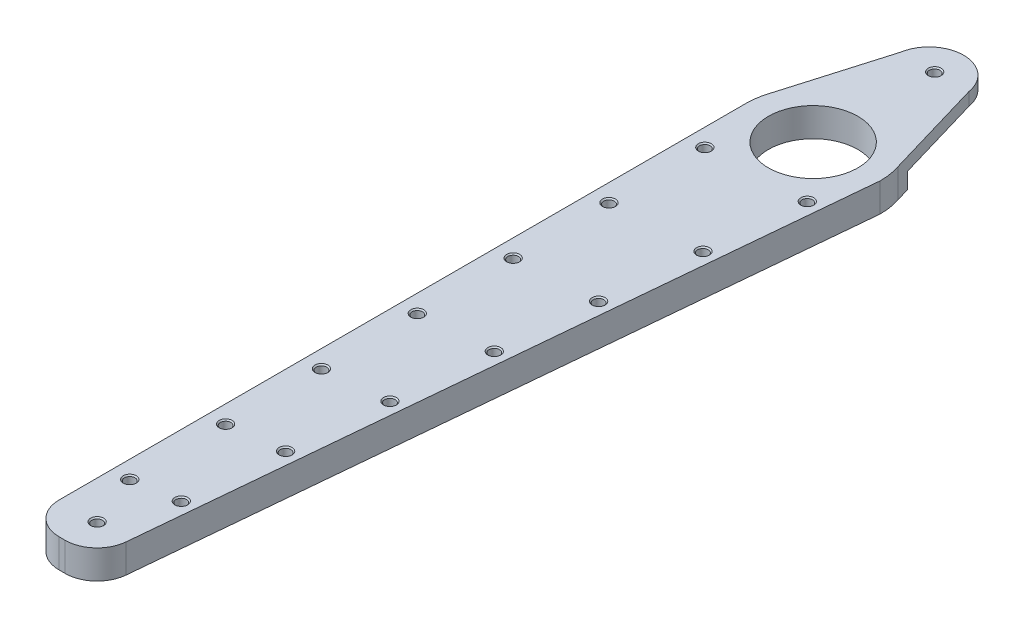
from build123d import *
from build123d.topology import SkipClean

# Parameters (mm, degrees)
EXTRUDE_1_DEPTH               = 15
CUT_EXTRUDE_1_DEPTH           = 4
SKETCH_3_R                    = 14
CUT_EXTRUDE_2_DEPTH           = 227.475164201
EXTRUDE_4_DEPTH               = 15
SKETCH_11_W                   = 17
SKETCH_11_H                   = 10
SKETCH_14_W                   = 6
SKETCH_14_H                   = 10
CUT_REVOLVE_4_ANGLE           = 60
CUT_REVOLVE_4_OTHER_WAY_ANGLE = 90
SKETCH_16_W                   = 9.609453317
SKETCH_16_H                   = 10
CUT_EXTRUDE_4_DEPTH           = 5
SKETCH_17_W                   = 9.609453317
SKETCH_17_H                   = 10
CUT_EXTRUDE_5_DEPTH           = 5
CUT_EXTRUDE_6_DEPTH           = 7.5
EXTRUDE_START                 = 1.5
EXTRUDE_6_DEPTH               = 1.5
SKETCH_21_R                   = 5
SKETCH_21_R_2                 = 14
EXTRUDE_7_DEPTH               = 1.5
HOLE_WIZARD_M4_1_D            = 3.3
HOLE_WIZARD_M4_1_DEPTH        = 9
HOLE_WIZARD_M4_1_CSINK_D      = 4.05
HOLE_WIZARD_M4_1_CSINK_ANGLE  = 90


with BuildPart() as part:
    # 草图1 → 凸台-拉伸1 (new body)
    with BuildSketch(Plane(origin=(0, 0, 0), x_dir=(1, 0, 0), z_dir=(0, 1, 0))):
        with BuildLine():
            Line((-21, 0), (-21, -215))
            ThreePointArc((-21, -215), (-18.071067812, -222.071067812), (-11, -225))
            Line((-11, -225), (-9.110127779, -225))
            ThreePointArc((-9.110127779, -225), (-2.375625019, -222.392325249), (0.846599179, -215.929294516))
            Line((0.846599179, -215.929294516), (21, 0))
            ThreePointArc((21, 0), (0, 21), (-21, 0))
        make_face()
    extrude(amount=EXTRUDE_1_DEPTH)

    # 草图2 → 切除-拉伸1 (cut)
    with BuildSketch(Plane.XZ):
        with BuildLine():
            Line((-6.487547308, 24.545681698), (-15.16946684, 197.954199749))
            ThreePointArc((-15.16946684, 197.954199749), (-9.006726896, 204.766554422), (-2.194372223, 198.603814478))
            Line((-2.194372223, 198.603814478), (6.487547308, 25.195296427))
            ThreePointArc((6.487547308, 25.195296427), (0.324807364, 18.382941754), (-6.487547308, 24.545681698))
        make_face()
    extrude(amount=-CUT_EXTRUDE_1_DEPTH, mode=Mode.SUBTRACT)

    # 草图3 → 切除-拉伸2 (cut, through all)
    with BuildSketch(Plane(origin=(0, 0, 0), x_dir=(-1, 0, 0), z_dir=(0, -1, 0))):
        with Locations(Location((0, 0, 0), (0, 0, 90))):
            Circle(SKETCH_3_R)
    extrude(amount=-CUT_EXTRUDE_2_DEPTH, mode=Mode.SUBTRACT)

    # 草图7 → 凸台-拉伸4 (add)
    with BuildSketch(Plane(origin=(0, 0, 0), x_dir=(1, 0, 0), z_dir=(0, 1, 0))):
        with BuildLine():
            Line((-10.693069191, 38.039100971), (-19.9158097, 6.66036966))
            ThreePointArc((-19.9158097, 6.66036966), (0, 21), (19.9158097, 6.66036966))
            Line((19.9158097, 6.66036966), (10.693069191, 38.039100971))
            ThreePointArc((10.693069191, 38.039100971), (0, 47.113526612), (-10.693069191, 38.039100971))
        make_face()
    extrude(amount=EXTRUDE_4_DEPTH)

    # 草图11 → 切除-旋转3 (revolve, cut)
    with BuildSketch(Plane(origin=(0, 0, 0), x_dir=(0, 0, -1), z_dir=(1, 0, 0)), mode=Mode.PRIVATE) as cut_revolve_3_sk:
        with Locations((51.539100971, 7.5)):
            Rectangle(SKETCH_11_W, SKETCH_11_H)
    revolve(cut_revolve_3_sk.sketch.rotate(Axis((0, 15, -38.039100971), (0, -1, 0)), 180), axis=Axis((0, 15, -38.039100971), (0, -1, 0)), mode=Mode.SUBTRACT)

    # 草图14 → 切除-旋转4 (revolve, cut)
    with BuildSketch(Plane(origin=(0, 0, 0), x_dir=(0, 0, -1), z_dir=(1, 0, 0))):
        with Locations((19.26034239, 7.5)):
            Rectangle(SKETCH_14_W, SKETCH_14_H)
    revolve(axis=Axis((0, 15, 0), (0, -1, 0)), revolution_arc=CUT_REVOLVE_4_ANGLE, mode=Mode.SUBTRACT)

    # 草图14 → 切除-旋转4 other way (revolve, cut)
    with BuildSketch(Plane(origin=(0, 0, 0), x_dir=(0, 0, -1), z_dir=(1, 0, 0))):
        with Locations((19.26034239, 7.5)):
            Rectangle(SKETCH_14_W, SKETCH_14_H)
    revolve(axis=Axis((0, 15, 0), (0, 1, 0)), revolution_arc=CUT_REVOLVE_4_OTHER_WAY_ANGLE, mode=Mode.SUBTRACT)

    # 草图16 → 切除-拉伸4 (cut)
    with BuildSketch(Plane(origin=(20.13407913, 0, -5.917746812), x_dir=(-0.2819890835944097, 0, -0.9594176133121516), z_dir=(0.9594176133121516, 0, -0.2819890835944097))):
        with Locations((12.229144047, 7.5)):
            Rectangle(SKETCH_16_W, SKETCH_16_H)
    extrude(amount=-CUT_EXTRUDE_4_DEPTH, mode=Mode.SUBTRACT)

    # 草图17 → 切除-拉伸5 (cut)
    with BuildSketch(Plane(origin=(-20.13407913, 0, -5.917746812), x_dir=(-0.28198908359441, 0, 0.9594176133121515), z_dir=(-0.9594176133121515, 0, -0.28198908359441))):
        with Locations((-12.229144047, 7.5)):
            Rectangle(SKETCH_17_W, SKETCH_17_H)
    extrude(amount=-CUT_EXTRUDE_5_DEPTH, mode=Mode.SUBTRACT)

    # 草图20 → 切除-拉伸6 (cut)
    with BuildSketch(Plane.XZ):
        with BuildLine():
            Line((21, 0), (0.846599179, 215.929294516))
            ThreePointArc((0.846599179, 215.929294516), (-2.375625019, 222.392325249), (-9.110127779, 225))
            Line((-9.110127779, 225), (-11, 225))
            ThreePointArc((-11, 225), (-18.071067812, 222.071067812), (-21, 215))
            Line((-21, 215), (-21, 0))
            ThreePointArc((-21, 0), (-20.727180268, -3.374018102), (-19.9158097, -6.66036966))
            Line((-19.9158097, -6.66036966), (-10.693069191, -38.039100971))
            ThreePointArc((-10.693069191, -38.039100971), (0, -47.113526612), (10.693069191, -38.039100971))
            Line((10.693069191, -38.039100971), (19.9158097, -6.66036966))
            ThreePointArc((19.9158097, -6.66036966), (20.727180268, -3.374018102), (21, 0))
        make_face()
    extrude(amount=-CUT_EXTRUDE_6_DEPTH, mode=Mode.SUBTRACT)

    # 草图22 → 凸台-拉伸6 (add)
    with BuildSketch(Plane.XZ.offset(-12.5).offset(EXTRUDE_START)):
        with BuildLine():
            Line((-19.9158097, -6.66036966), (-10.693069191, -38.039100971))
            ThreePointArc((-10.693069191, -38.039100971), (0, -47.113526612), (10.693069191, -38.039100971))
            Line((10.693069191, -38.039100971), (18.700124508, -10.796521919))
            Line((18.700124508, -10.796521919), (14.081869584, -8.130171195))
            ThreePointArc((14.081869584, -8.130171195), (8.995321483, -13.545586959), (2.030780118, -16.133030303))
            ThreePointArc((2.030780118, -16.133030303), (0, -16.039100971), (-2.030780118, -16.133030303))
            ThreePointArc((-2.030780118, -16.133030303), (-12.194669218, -10.755871759), (-16.26034239, 0))
            Line((-16.26034239, 0), (-21, 0))
            ThreePointArc((-21, 0), (-20.727180268, -3.374018102), (-19.9158097, -6.66036966))
        make_face()
    extrude(amount=-EXTRUDE_6_DEPTH)

    # 草图21 → 凸台-拉伸7 (add)
    # profile 1 of 2: a face of its own
    with SkipClean():  # the faces are left unmerged after this step: merging them gives an invalid solid
        with BuildSketch(Plane.XZ.offset(-7.5).offset(EXTRUDE_START)):
            with Locations(Location((0, -38.039100971, 0), (0, 0, 270))):
                Circle(SKETCH_21_R)
        # profile 2 of 2: a face of its own
        with BuildSketch(Plane.XZ.offset(-7.5).offset(EXTRUDE_START)):
            with BuildLine():
                Line((-21, 0), (-16.26034239, 0))
                ThreePointArc((-16.26034239, 0), (-12.194669218, -10.755871759), (-2.030780118, -16.133030303))
                ThreePointArc((-2.030780118, -16.133030303), (0, -16.039100971), (2.030780118, -16.133030303))
                ThreePointArc((2.030780118, -16.133030303), (8.995321483, -13.545586959), (14.081869584, -8.130171195))
                Line((14.081869584, -8.130171195), (18.700124508, -10.796521919))
                Line((18.700124508, -10.796521919), (19.9158097, -6.66036966))
                ThreePointArc((19.9158097, -6.66036966), (20.727180268, -3.374018102), (21, 0))
                Line((21, 0), (0.846599179, 215.929294516))
                ThreePointArc((0.846599179, 215.929294516), (-2.375625019, 222.392325249), (-9.110127779, 225))
                Line((-9.110127779, 225), (-11, 225))
                ThreePointArc((-11, 225), (-18.071067812, 222.071067812), (-21, 215))
                Line((-21, 215), (-21, 0))
            make_face()
            with Locations(Location((0, 0, 0), (0, 0, 270))):
                Circle(SKETCH_21_R_2, mode=Mode.SUBTRACT)
        extrude(amount=-EXTRUDE_7_DEPTH)

    # M4 螺纹孔1
    with Locations(Plane(origin=(0, 15, 0), x_dir=(1, 0, 0), z_dir=(0, 1, 0))):
        with Locations((-1.550565844, -196.226581502), (-4.338449392, -226.096762374), (-9.110127779, -215), (15.176735444, -17.005496271), (0, 38.039100971), (-15.5, -18.398087501), (-15.5, -48.398087501), (-15.5, -78.398087501), (-15.5, -108.398087501), (-15.5, -138.398087501), (-15.5, -168.398087501), (-15.5, -198.398087501), (12.388851896, -46.875677143), (9.600968348, -76.745858014), (6.8130848, -106.616038886), (4.025201252, -136.486219758), (1.237317704, -166.35640063)):
            CounterSinkHole(HOLE_WIZARD_M4_1_D / 2, HOLE_WIZARD_M4_1_CSINK_D / 2, depth=HOLE_WIZARD_M4_1_DEPTH, counter_sink_angle=HOLE_WIZARD_M4_1_CSINK_ANGLE)


solid = part.part
